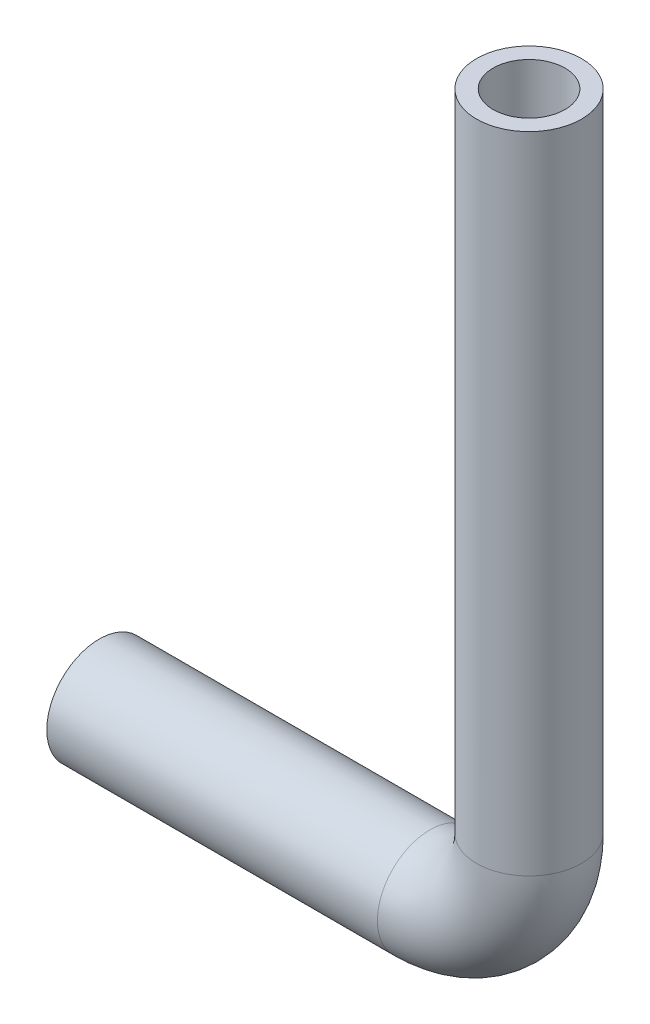
from build123d import *

# Parameters (mm, degrees)
TUBE_PROFILE_R   = 3.175
TUBE_PROFILE_R_2 = 2.175


with BuildPart() as part:
    # Tube: sweep along a curve in space
    with BuildLine() as tube_path:
        Line((154, 167, 50), (174, 167, 50))
        ThreePointArc((180, 173, 50), (178.242640687, 168.757359313, 50), (174, 167, 50))
        Line((180, 173, 50), (180, 212, 50))
    # Tube profile (on start of the path) → Tube (sweep)
    with BuildSketch(Plane(origin=(154, 167, 50), x_dir=(0, 0, 1), z_dir=(1, 0, 0))):
        Circle(TUBE_PROFILE_R)
        Circle(TUBE_PROFILE_R_2, mode=Mode.SUBTRACT)
    sweep(path=tube_path.line)


solid = part.part
